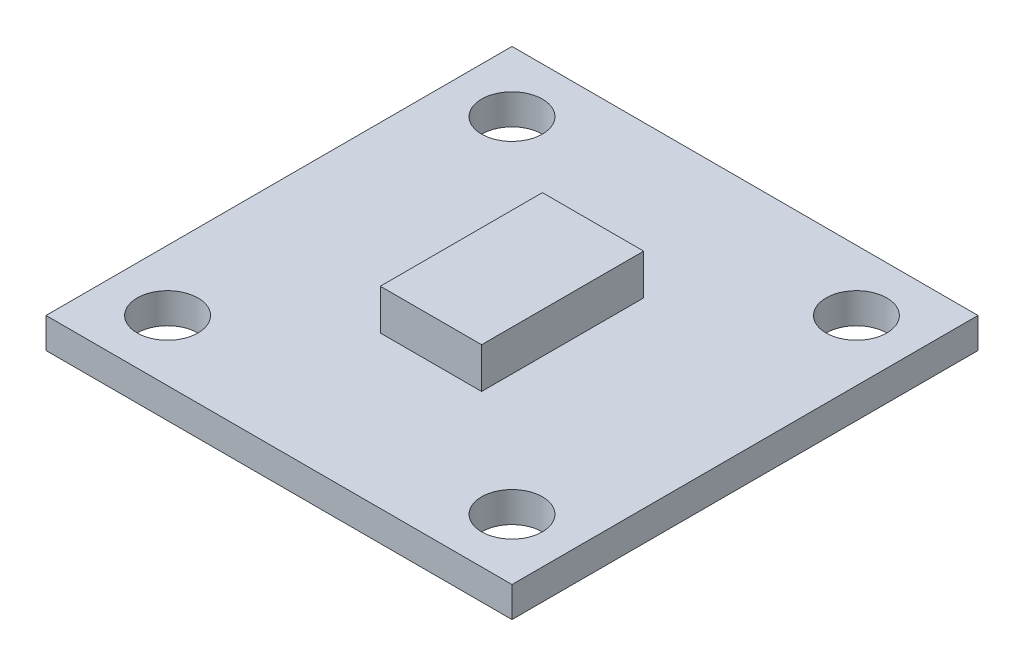
from build123d import *

# Parameters (mm, degrees)
SKETCH_1_W      = 23
SKETCH_1_H      = 23
SKETCH_1_R      = 1.5
EXTRUDE_1_DEPTH = 1.5
SKETCH_2_W      = 5
SKETCH_2_H      = 8
EXTRUDE_2_DEPTH = 2


with BuildPart() as part:
    # 草图1 → 凸台-拉伸1 (new body)
    with BuildSketch(Plane(origin=(0, 0, 0), x_dir=(1, 0, 0), z_dir=(0, 1, 0))):
        Rectangle(SKETCH_1_W, SKETCH_1_H)
        with Locations(Location((8.5, 8.5, 0), (0, 0, 270))):
            Circle(SKETCH_1_R, mode=Mode.SUBTRACT)
        with Locations(Location((8.5, -8.5, 0), (0, 0, 90))):
            Circle(SKETCH_1_R, mode=Mode.SUBTRACT)
        with Locations(Location((-8.5, -8.5, 0), (0, 0, 270))):
            Circle(SKETCH_1_R, mode=Mode.SUBTRACT)
        with Locations(Location((-8.5, 8.5, 0), (0, 0, 90))):
            Circle(SKETCH_1_R, mode=Mode.SUBTRACT)
    extrude(amount=EXTRUDE_1_DEPTH)

    # 草图2 → 凸台-拉伸2 (add)
    with BuildSketch(Plane(origin=(0, 1.5, 0), x_dir=(1, 0, 0), z_dir=(0, 1, 0))):
        Rectangle(SKETCH_2_W, SKETCH_2_H)
    extrude(amount=EXTRUDE_2_DEPTH)


solid = part.part
